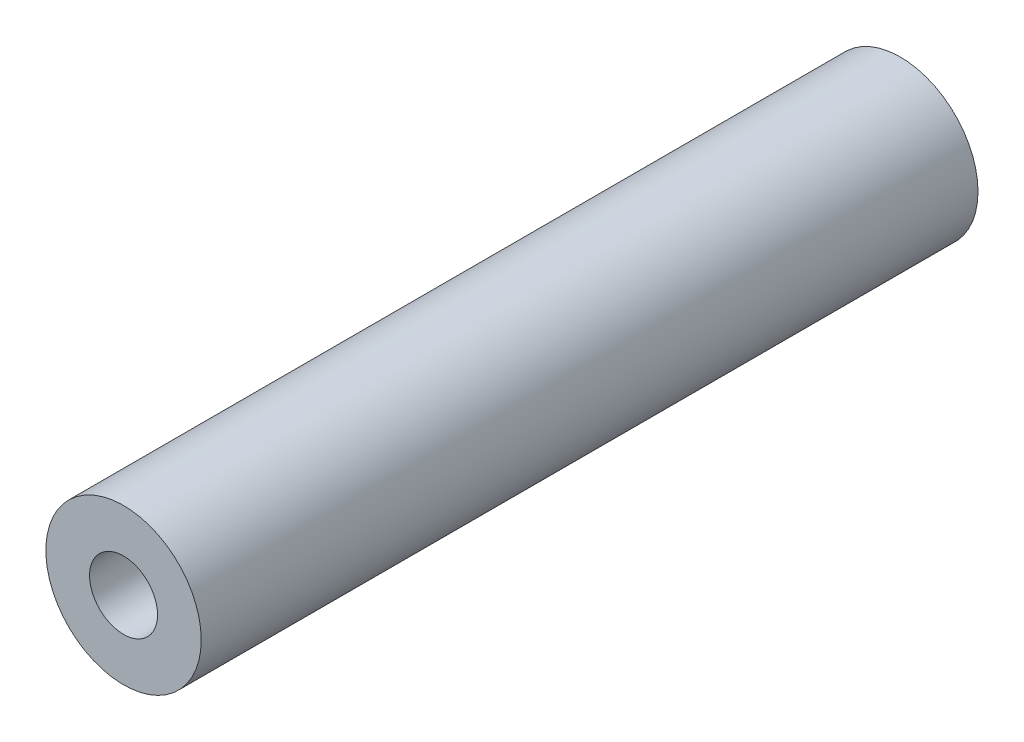
from build123d import *

# Parameters (mm, degrees)
SKETCH_1_R      = 4
SKETCH_1_R_2    = 1.75
EXTRUDE_1_DEPTH = 40


with BuildPart() as part:
    # Эскиз1 → Бобышка-Вытянуть1 (new body)
    with BuildSketch(Plane.XY):
        Circle(SKETCH_1_R)
        Circle(SKETCH_1_R_2, mode=Mode.SUBTRACT)
    extrude(amount=EXTRUDE_1_DEPTH)


solid = part.part
